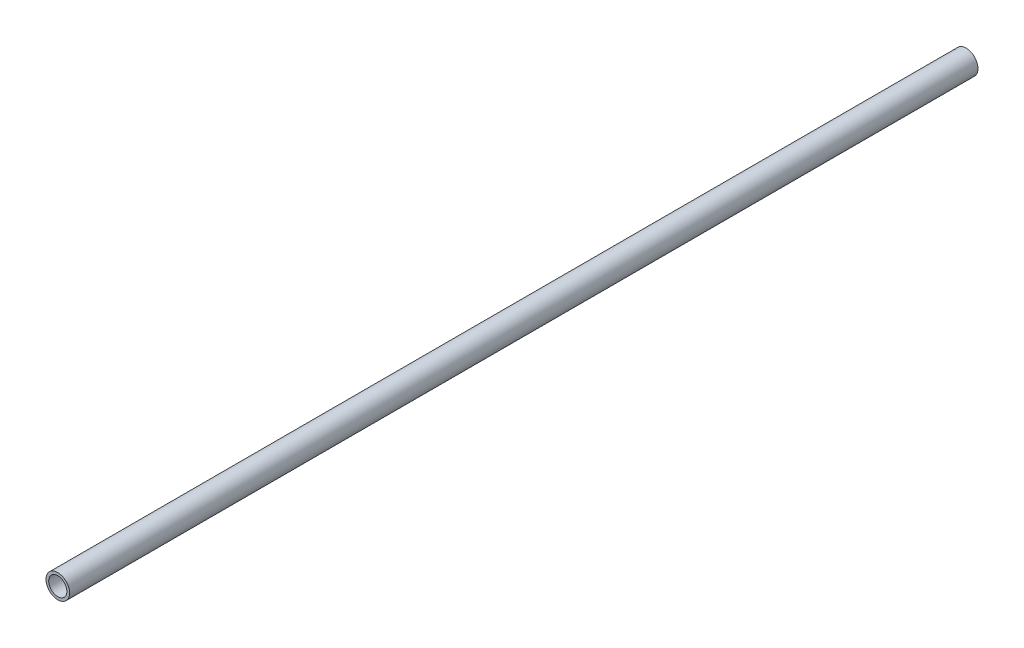
from build123d import *

# Parameters (mm, degrees)
SKETCH1_R           = 6.5
SKETCH1_R_2         = 5
BOSS_EXTRUDE1_DEPTH = 500


with BuildPart() as part:
    # Sketch1 → Boss-Extrude1 (new body)
    with BuildSketch(Plane.XY):
        with Locations((390.7614039, 31.081528881)):
            Circle(SKETCH1_R)
        with Locations((390.7614039, 31.081528881)):
            Circle(SKETCH1_R_2, mode=Mode.SUBTRACT)
    extrude(amount=BOSS_EXTRUDE1_DEPTH)


solid = part.part
